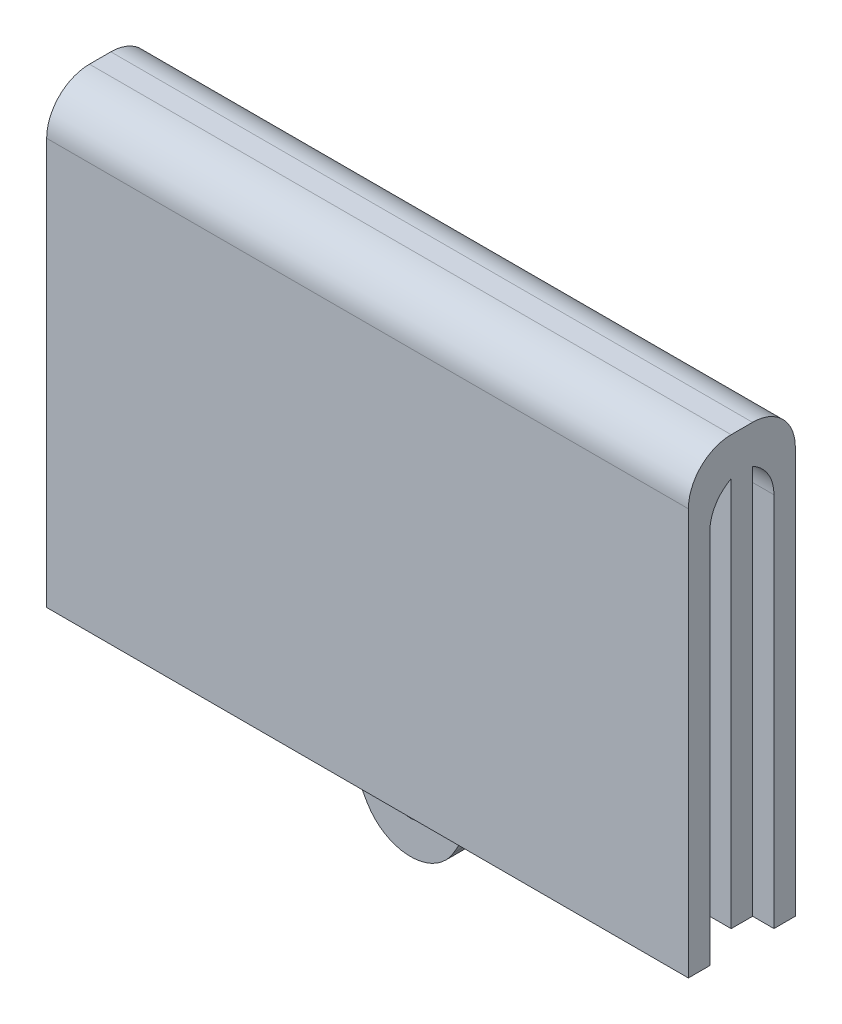
from build123d import *

# Parameters (mm, degrees)
SKETCH_1_W      = 60
SKETCH_1_H      = 2
EXTRUDE_1_DEPTH = 40
SKETCH_3_R      = 1.55
EXTRUDE_2_DEPTH = 2
EXTRUDE_3_DEPTH = 60


with BuildPart() as part:
    # 草图1 → 凸台-拉伸1 (new body)
    with BuildSketch(Plane(origin=(0, 0, 0), x_dir=(1, 0, 0), z_dir=(0, 1, 0))):
        Rectangle(SKETCH_1_W, SKETCH_1_H)
    extrude(amount=EXTRUDE_1_DEPTH)



with BuildPart() as body_2:
    # 草图3 → 凸台-拉伸2 (new, through all)
    with BuildSketch(Plane(origin=(0, 0, -1), x_dir=(-1, 0, 0), z_dir=(0, 0, -1))):
        with BuildLine():
            Line((-7.994757435, 0), (-4.05536846, -6.823221856))
            ThreePointArc((-4.05536846, -6.823221856), (-0.01683957, -9.154867598), (4.02168932, -6.823221856))
            Line((4.02168932, -6.823221856), (7.961078295, 0))
            Line((7.961078295, 0), (-7.994757435, 0))
        make_face()
        with Locations((-0.01683957, -4.491576114)):
            Circle(SKETCH_3_R, mode=Mode.SUBTRACT)
    extrude(amount=-EXTRUDE_2_DEPTH)


with BuildPart() as part_1:
    add(part.part)

    add(body_2.part)  # 凸台-拉伸3 merges body 2
    # 草图4 → 凸台-拉伸3 (add, through all)
    with BuildSketch(Plane(origin=(30, 0, 0), x_dir=(0, 0, -1), z_dir=(1, 0, 0))):
        with BuildLine():
            Line((5, 36), (5, -1.993440082))
            Line((5, -1.993440082), (3, -1.993440082))
            Line((3, -1.993440082), (3, 33.134423916))
            ThreePointArc((3, 33.134423916), (2.461049161, 35.065394885), (1, 36.43814841))
            Line((1, 36.43814841), (1, 40))
            ThreePointArc((1, 40), (3.828427125, 38.828427125), (5, 36))
        make_face()
        with BuildLine():
            Line((-5, 36), (-5, -1.993440082))
            Line((-5, -1.993440082), (-3, -1.993440082))
            Line((-3, -1.993440082), (-3, 33.134423916))
            ThreePointArc((-3, 33.134423916), (-2.461049161, 35.065394885), (-1, 36.43814841))
            Line((-1, 36.43814841), (-1, 40))
            ThreePointArc((-1, 40), (-3.828427125, 38.828427125), (-5, 36))
        make_face()
    extrude(amount=-EXTRUDE_3_DEPTH)


solid = part_1.part
